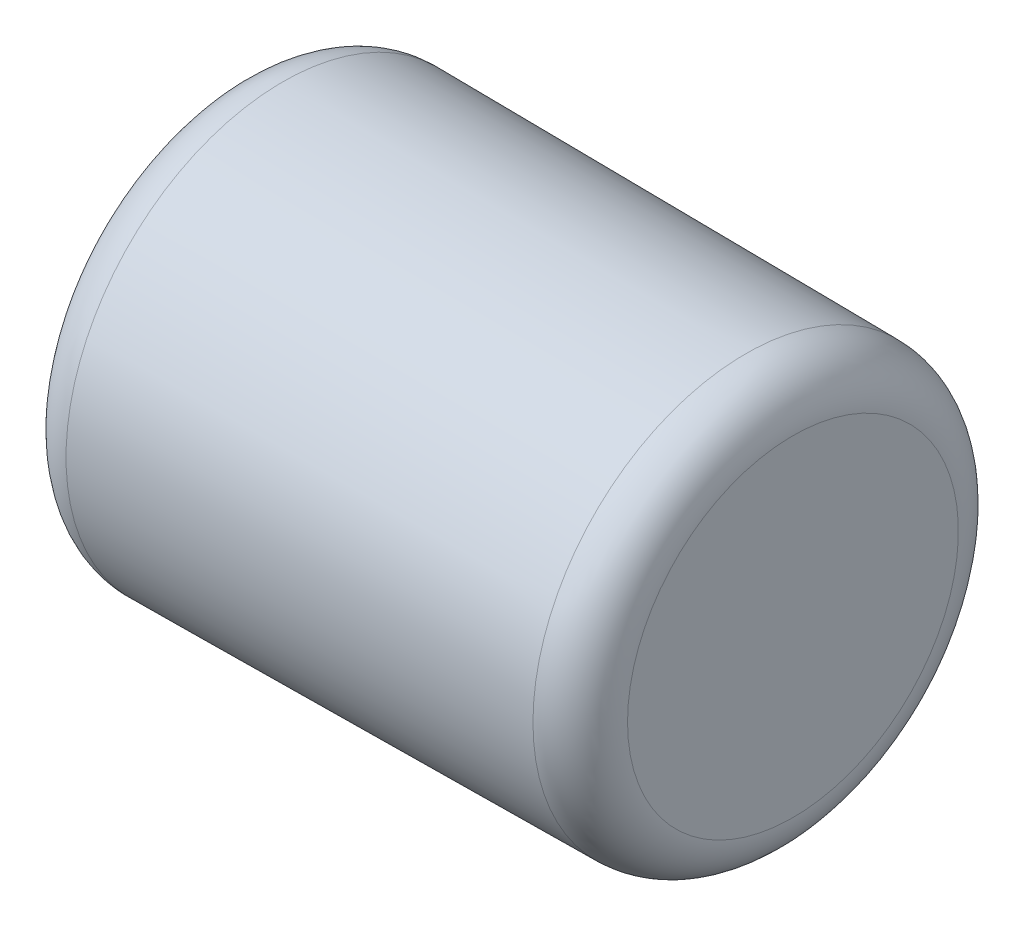
from build123d import *

# Parameters (mm, degrees)
FILLET1_R = 2


with BuildPart() as part:
    # Sketch1 → Revolve1 (revolve)
    with BuildSketch(Plane.XY, mode=Mode.PRIVATE) as revolve1_sk:
        Polygon((0, 0), (0, 9.15), (23.5, 8.95), (23.5, 0), align=None)
    revolve(revolve1_sk.sketch.rotate(Axis((-5.066808465, 0, 0), (1, 0, 0)), 90), axis=Axis((-5.066808465, 0, 0), (1, 0, 0)))

    # Fillet1
    fillet1_edges = [part.edges().sort_by_distance(p)[0] for p in [
        (23.5, 0, -8.95),
        (0, 0, -9.15),
    ]]
    fillet(fillet1_edges, radius=FILLET1_R)


solid = part.part
